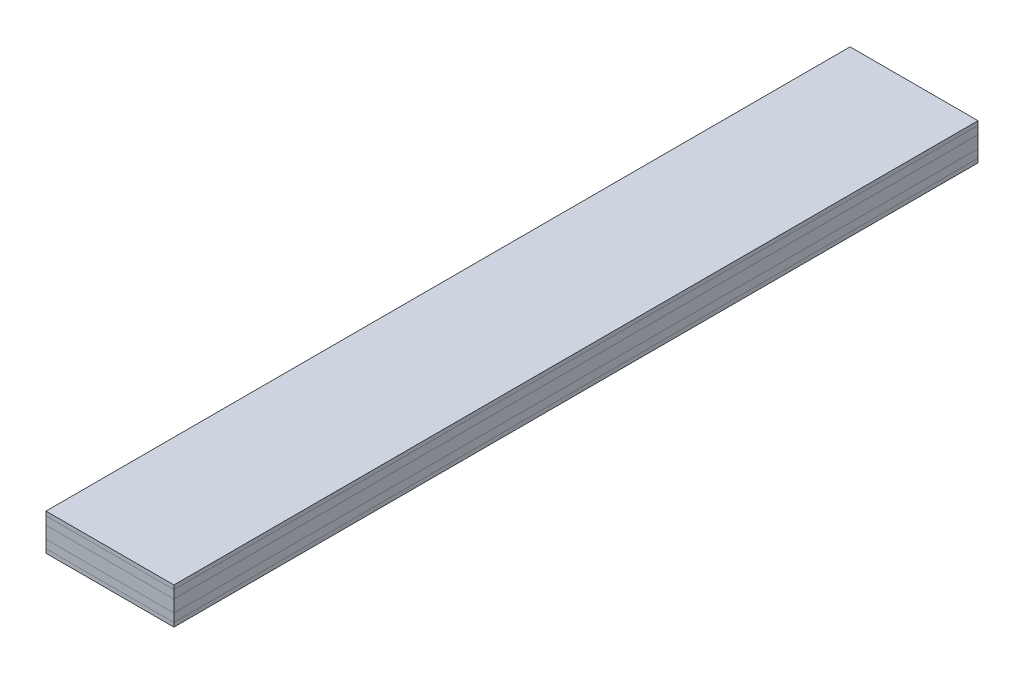
from build123d import *

# Parameters (mm, degrees)
SKETCH3_W                = 609.6
SKETCH3_H                = 1219.2
BOSS_EXTRUDE1_DEPTH      = 25.4
SPLIT1_SURFACE_1_1_BACK  = 1364.344
SPLIT1_SURFACE_1_1_DEPTH = 2728.688
SPLIT1_SURFACE_1_2_BACK  = 1364.344
SPLIT1_SURFACE_1_2_DEPTH = 2728.688
SPLIT1_SURFACE_2_3_BACK  = 1364.344
SPLIT1_SURFACE_2_3_DEPTH = 2728.688
SPLIT1_SURFACE_2_4_BACK  = 1364.344
SPLIT1_SURFACE_2_4_DEPTH = 2728.688
SPLIT1_SURFACE_3_5_BACK  = 1364.344
SPLIT1_SURFACE_3_5_DEPTH = 2728.688
SPLIT1_SURFACE_3_6_BACK  = 1364.344
SPLIT1_SURFACE_3_6_DEPTH = 2728.688
SPLIT1_SURFACE_4_7_BACK  = 1364.344
SPLIT1_SURFACE_4_7_DEPTH = 2728.688
SPLIT1_SURFACE_4_8_BACK  = 1364.344
SPLIT1_SURFACE_4_8_DEPTH = 2728.688
CUT_EXTRUDE1_DEPTH       = 25.4


with BuildPart() as part:
    # Sketch3 → Boss-Extrude1 (new body)
    with BuildSketch(Plane(origin=(0, 0, 0), x_dir=(1, 0, 0), z_dir=(0, 1, 0))):
        Rectangle(SKETCH3_W, SKETCH3_H)
    extrude(amount=-BOSS_EXTRUDE1_DEPTH)


with BuildPart() as body_2:
    # Split1: the piece behind the surface
    add(part.part)
    # Split1 surface 1: a surface, the sketch's curves swept straight by 2728.688 mm
    with BuildLine(Plane.XY.offset(-SPLIT1_SURFACE_1_1_BACK), mode=Mode.PRIVATE) as split1_surface_1_1_path:
        Line((-335.28, -22.577777778), (335.28, -22.577777778))
    split1_surface_1_1 = Shell.extrude(split1_surface_1_1_path.wire(), (0 * SPLIT1_SURFACE_1_1_DEPTH, 0 * SPLIT1_SURFACE_1_1_DEPTH, 1 * SPLIT1_SURFACE_1_1_DEPTH))
    split(bisect_by=split1_surface_1_1, keep=Keep.BOTTOM)


with BuildPart() as part_1:
    add(part.part)

    # Split1: split by a surface, the side it looks to stays
    # Split1 surface 1: a surface, the sketch's curves swept straight by 2728.688 mm
    with BuildLine(Plane.XY.offset(-SPLIT1_SURFACE_1_2_BACK), mode=Mode.PRIVATE) as split1_surface_1_2_path:
        Line((-335.28, -22.577777778), (335.28, -22.577777778))
    split1_surface_1_2 = Shell.extrude(split1_surface_1_2_path.wire(), (0 * SPLIT1_SURFACE_1_2_DEPTH, 0 * SPLIT1_SURFACE_1_2_DEPTH, 1 * SPLIT1_SURFACE_1_2_DEPTH))
    split(bisect_by=split1_surface_1_2, keep=Keep.TOP)


with BuildPart() as body_3:
    # Split1 2: the piece behind the surface
    add(part_1.part)
    # Split1 surface 2: a surface, the sketch's curves swept straight by 2728.688 mm
    with BuildLine(Plane.XY.offset(-SPLIT1_SURFACE_2_3_BACK), mode=Mode.PRIVATE) as split1_surface_2_3_path:
        Line((-335.28, -16.933333333), (335.28, -16.933333333))
    split1_surface_2_3 = Shell.extrude(split1_surface_2_3_path.wire(), (0 * SPLIT1_SURFACE_2_3_DEPTH, 0 * SPLIT1_SURFACE_2_3_DEPTH, 1 * SPLIT1_SURFACE_2_3_DEPTH))
    split(bisect_by=split1_surface_2_3, keep=Keep.BOTTOM)


with BuildPart() as part_2:
    add(part_1.part)

    # Split1 2: split by a surface, the side it looks to stays
    # Split1 surface 2: a surface, the sketch's curves swept straight by 2728.688 mm
    with BuildLine(Plane.XY.offset(-SPLIT1_SURFACE_2_4_BACK), mode=Mode.PRIVATE) as split1_surface_2_4_path:
        Line((-335.28, -16.933333333), (335.28, -16.933333333))
    split1_surface_2_4 = Shell.extrude(split1_surface_2_4_path.wire(), (0 * SPLIT1_SURFACE_2_4_DEPTH, 0 * SPLIT1_SURFACE_2_4_DEPTH, 1 * SPLIT1_SURFACE_2_4_DEPTH))
    split(bisect_by=split1_surface_2_4, keep=Keep.TOP)


with BuildPart() as body_4_2:
    # Split1 3: the piece behind the surface
    add(part_2.part)
    # Split1 surface 3: a surface, the sketch's curves swept straight by 2728.688 mm
    with BuildLine(Plane.XY.offset(-SPLIT1_SURFACE_3_5_BACK), mode=Mode.PRIVATE) as split1_surface_3_5_path:
        Line((-335.28, -2.822222222), (335.28, -2.822222222))
    split1_surface_3_5 = Shell.extrude(split1_surface_3_5_path.wire(), (0 * SPLIT1_SURFACE_3_5_DEPTH, 0 * SPLIT1_SURFACE_3_5_DEPTH, 1 * SPLIT1_SURFACE_3_5_DEPTH))
    split(bisect_by=split1_surface_3_5, keep=Keep.BOTTOM)


with BuildPart() as part_3:
    add(part_2.part)

    # Split1 3: split by a surface, the side it looks to stays
    # Split1 surface 3: a surface, the sketch's curves swept straight by 2728.688 mm
    with BuildLine(Plane.XY.offset(-SPLIT1_SURFACE_3_6_BACK), mode=Mode.PRIVATE) as split1_surface_3_6_path:
        Line((-335.28, -2.822222222), (335.28, -2.822222222))
    split1_surface_3_6 = Shell.extrude(split1_surface_3_6_path.wire(), (0 * SPLIT1_SURFACE_3_6_DEPTH, 0 * SPLIT1_SURFACE_3_6_DEPTH, 1 * SPLIT1_SURFACE_3_6_DEPTH))
    split(bisect_by=split1_surface_3_6, keep=Keep.TOP)


with BuildPart() as body_5_2:
    # Split1 4 body 4 2: the piece behind the surface
    add(body_4_2.part)
    # Split1 surface 4: a surface, the sketch's curves swept straight by 2728.688 mm
    with BuildLine(Plane.XY.offset(-SPLIT1_SURFACE_4_7_BACK), mode=Mode.PRIVATE) as split1_surface_4_7_path:
        Line((-335.28, -8.466666667), (335.28, -8.466666667))
    split1_surface_4_7 = Shell.extrude(split1_surface_4_7_path.wire(), (0 * SPLIT1_SURFACE_4_7_DEPTH, 0 * SPLIT1_SURFACE_4_7_DEPTH, 1 * SPLIT1_SURFACE_4_7_DEPTH))
    split(bisect_by=split1_surface_4_7, keep=Keep.BOTTOM)


with BuildPart() as body_4_2_1:
    add(body_4_2.part)

    # Split1 4 body 4 2: split by a surface, the side it looks to stays
    # Split1 surface 4: a surface, the sketch's curves swept straight by 2728.688 mm
    with BuildLine(Plane.XY.offset(-SPLIT1_SURFACE_4_8_BACK), mode=Mode.PRIVATE) as split1_surface_4_8_path:
        Line((-335.28, -8.466666667), (335.28, -8.466666667))
    split1_surface_4_8 = Shell.extrude(split1_surface_4_8_path.wire(), (0 * SPLIT1_SURFACE_4_8_DEPTH, 0 * SPLIT1_SURFACE_4_8_DEPTH, 1 * SPLIT1_SURFACE_4_8_DEPTH))
    split(bisect_by=split1_surface_4_8, keep=Keep.TOP)


with BuildPart() as cut_extrude1_tool:
    # Sketch6 → Cut-Extrude1 (new body)
    with BuildSketch(Plane(origin=(0, 0, 0), x_dir=(1, 0, 0), z_dir=(0, 1, 0))):
        Polygon((-304.8, -609.6), (215.9, -609.6), (215.9, -50.8), (304.8, -50.8), (304.8, 609.6), (-304.8, 609.6), align=None)
    extrude(amount=-CUT_EXTRUDE1_DEPTH)


with BuildPart() as part_4:
    add(part_3.part)

    # Cut-Extrude1: cut by cut_extrude1_tool
    add(cut_extrude1_tool.part, mode=Mode.SUBTRACT)


with BuildPart() as body_2_1:
    add(body_2.part)

    # Cut-Extrude1: cut by cut_extrude1_tool
    add(cut_extrude1_tool.part, mode=Mode.SUBTRACT)


with BuildPart() as body_3_1:
    add(body_3.part)

    # Cut-Extrude1: cut by cut_extrude1_tool
    add(cut_extrude1_tool.part, mode=Mode.SUBTRACT)


with BuildPart() as body_4_2_2:
    add(body_4_2_1.part)

    # Cut-Extrude1: cut by cut_extrude1_tool
    add(cut_extrude1_tool.part, mode=Mode.SUBTRACT)


with BuildPart() as body_5_2_1:
    add(body_5_2.part)

    # Cut-Extrude1: cut by cut_extrude1_tool
    add(cut_extrude1_tool.part, mode=Mode.SUBTRACT)


solid = Compound([part_4.part, body_2_1.part, body_3_1.part, body_4_2_2.part, body_5_2_1.part])
